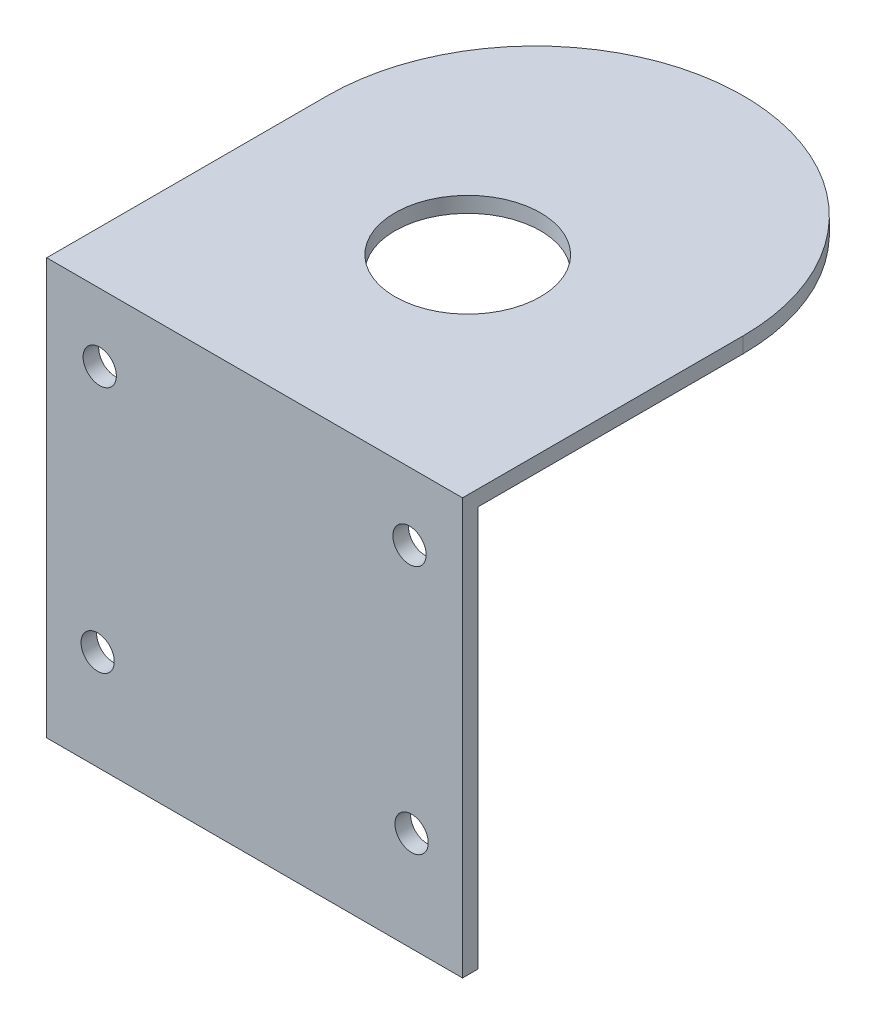
from build123d import *

# Parameters (mm, degrees)
SKETCH1_W           = 40
SKETCH1_H           = 40
SKETCH1_R           = 1.6
BOSS_EXTRUDE1_DEPTH = 1.5
SKETCH3_W           = 40
SKETCH3_H           = 1.5
BOSS_EXTRUDE2_DEPTH = 45.5
CUT_EXTRUDE1_DEPTH  = 64.798510954
SKETCH5_R           = 7
CUT_EXTRUDE2_DEPTH  = 64.798510954


with BuildPart() as part:
    # Sketch1 → Boss-Extrude1 (new body)
    with BuildSketch(Plane.XY):
        Rectangle(SKETCH1_W, SKETCH1_H)
        with Locations((14.9, 13.5)):
            Circle(SKETCH1_R, mode=Mode.SUBTRACT)
        with Locations(Location((-14.9, 13.5, 0), (0, 0, 180))):
            Circle(SKETCH1_R, mode=Mode.SUBTRACT)
        with Locations((15.1, -10.399163165)):
            Circle(SKETCH1_R, mode=Mode.SUBTRACT)
        with Locations(Location((-15.1, -10.399163165, 0), (0, 0, 180))):
            Circle(SKETCH1_R, mode=Mode.SUBTRACT)
    extrude(amount=BOSS_EXTRUDE1_DEPTH)

    # Sketch3 → Boss-Extrude2 (add)
    with BuildSketch(Plane(origin=(0, 0, 0), x_dir=(-1, 0, 0), z_dir=(0, 0, -1))):
        with Locations((0, 19.25)):
            Rectangle(SKETCH3_W, SKETCH3_H)
    extrude(amount=BOSS_EXTRUDE2_DEPTH)

    # Sketch4 → Cut-Extrude1 (cut, through all)
    with BuildSketch(Plane(origin=(0, 20, 0), x_dir=(1, 0, 0), z_dir=(0, 1, 0))):
        with BuildLine():
            ThreePointArc((0, 45.5), (14.142135624, 39.642135624), (20, 25.5))
            Line((20, 25.5), (20, 45.5))
            Line((20, 45.5), (0, 45.5))
        make_face()
        with BuildLine():
            Line((-20, 45.5), (-20, 25.5))
            ThreePointArc((-20, 25.5), (-14.142135624, 39.642135624), (0, 45.5))
            Line((0, 45.5), (-20, 45.5))
        make_face()
    extrude(amount=-CUT_EXTRUDE1_DEPTH, mode=Mode.SUBTRACT)

    # Sketch5 → Cut-Extrude2 (cut, through all)
    with BuildSketch(Plane(origin=(0, 20, 0), x_dir=(1, 0, 0), z_dir=(0, 1, 0))):
        with Locations(Location((0, 19, 0), (0, 0, 270))):
            Circle(SKETCH5_R)
    extrude(amount=-CUT_EXTRUDE2_DEPTH, mode=Mode.SUBTRACT)


solid = part.part
